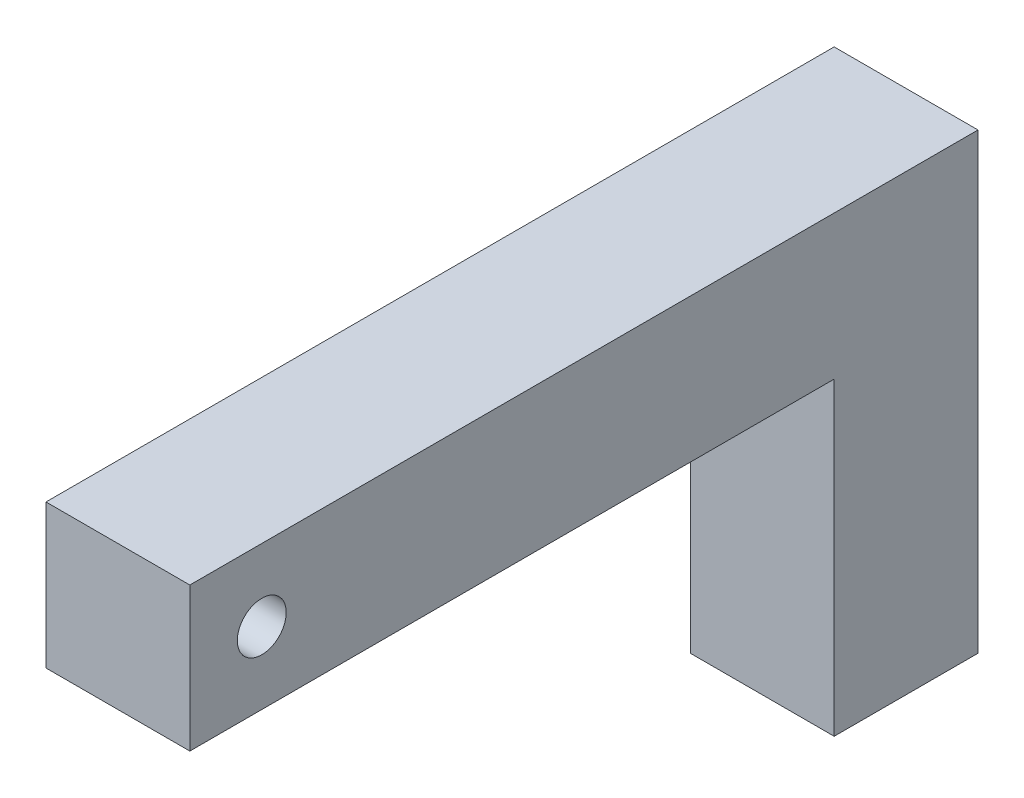
from build123d import *

# Parameters (mm, degrees)
SKETCH1_R           = 1.7
BOSS_EXTRUDE1_DEPTH = 10


with BuildPart() as part:
    # Sketch1 → Boss-Extrude1 (new body)
    with BuildSketch(Plane(origin=(0, 0, 0), x_dir=(0, 0, -1), z_dir=(1, 0, 0))):
        Polygon((0, 0), (0, 10), (54.794520548, 10), (54.794520548, -21.506849315), (44.794520548, -21.506849315), (44.794520548, 0), align=None)
        with Locations((5, 5)):
            Circle(SKETCH1_R, mode=Mode.SUBTRACT)
    extrude(amount=BOSS_EXTRUDE1_DEPTH)


solid = part.part
